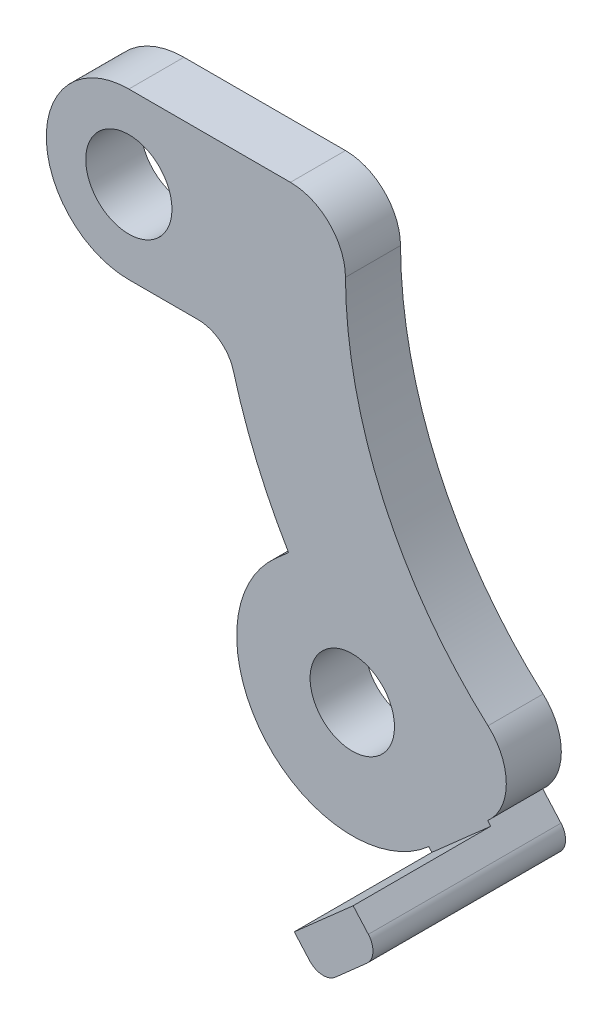
from build123d import *

# Parameters (mm, degrees)
SKETCH1_R           = 2.35
SKETCH1_R_2         = 2.3
BOSS_EXTRUDE2_DEPTH = 3
SKETCH2_W           = 4.283202477
SKETCH2_H           = 3
BOSS_EXTRUDE3_DEPTH = 2.5
BOSS_EXTRUDE4_DEPTH = 7.5
FILLET1_R           = 1
SKETCH4_W           = 4.283202477
SKETCH4_H           = 7.5
CUT_EXTRUDE1_DEPTH  = 0.25


with BuildPart() as part:
    # Sketch1 → Boss-Extrude2 (new body)
    with BuildSketch(Plane.XY.offset(-130.24387898)):
        with BuildLine():
            Line((-15.010059364, 38.189351968), (-15.708117617, 37.572463316))
            ThreePointArc((-15.708117617, 37.572463316), (-16.257044738, 28.67984396), (-7.364425381, 28.130916839))
            Line((-7.364425381, 28.130916839), (-4.154897186, 30.967244081))
            ThreePointArc((-4.154897186, 30.967244081), (-3.141509811, 33.204488286), (-4.138848078, 35.44893298))
            ThreePointArc((-4.138848078, 35.44893298), (-9.854378586, 43.268649811), (-11.908958835, 52.734058429))
            ThreePointArc((-11.908958835, 52.734058429), (-12.792945326, 54.845611755), (-14.908920841, 55.718960016))
            Line((-14.908920841, 55.718960016), (-23.716053845, 55.718960016))
            ThreePointArc((-23.716053845, 55.718960016), (-28.216053845, 51.218960016), (-23.716053845, 46.718960016))
            Line((-23.716053845, 46.718960016), (-19.942226175, 46.718960016))
            ThreePointArc((-19.942226175, 46.718960016), (-18.729620599, 46.309427783), (-18.013616093, 45.248547734))
            ThreePointArc((-18.013616093, 45.248547734), (-16.74918621, 41.617962479), (-15.010059364, 38.189351968))
        make_face()
        with Locations((-23.716053845, 51.218960016)):
            Circle(SKETCH1_R, mode=Mode.SUBTRACT)
        with Locations((-11.536271499, 32.851690078)):
            Circle(SKETCH1_R_2, mode=Mode.SUBTRACT)
    extrude(amount=BOSS_EXTRUDE2_DEPTH)

    # Sketch2 → Boss-Extrude3 (add)
    with BuildSketch(Plane(origin=(-17.188019546, 19.449601065, 0), x_dir=(0.7493290854811405, 0.6621977964717171, 0), z_dir=(0.6621977964717171, -0.7493290854811405, 0))):
        with Locations((15.251454246, -128.74387898)):
            Rectangle(SKETCH2_W, SKETCH2_H)
    extrude(amount=BOSS_EXTRUDE3_DEPTH)

    # Sketch3 → Boss-Extrude4 (add)
    with BuildSketch(Plane.XY.offset(-127.24387898)):
        Polygon((-7.364425381, 28.130916839), (-4.154897186, 30.967244081), (-2.499402695, 29.093921367), (-5.70893089, 26.257594125), align=None)
    extrude(amount=BOSS_EXTRUDE4_DEPTH)

    # Fillet1
    fillet1_edges = [part.edges().sort_by_distance(p)[0] for p in [
        (-5.70893089, 26.257594125, -124.99387898),
        (-2.499402695, 29.093921367, -124.99387898),
    ]]
    fillet(fillet1_edges, radius=FILLET1_R)

    # Sketch4 → Cut-Extrude1 (cut)
    with BuildSketch(Plane(origin=(-17.188019546, 19.449601065, 0), x_dir=(0.7493290854811406, 0.6621977964717171, 0), z_dir=(-0.6621977964717171, 0.7493290854811406, 0))):
        with Locations((15.251454246, 123.49387898)):
            Rectangle(SKETCH4_W, SKETCH4_H)
    extrude(amount=-CUT_EXTRUDE1_DEPTH, mode=Mode.SUBTRACT)


solid = part.part
